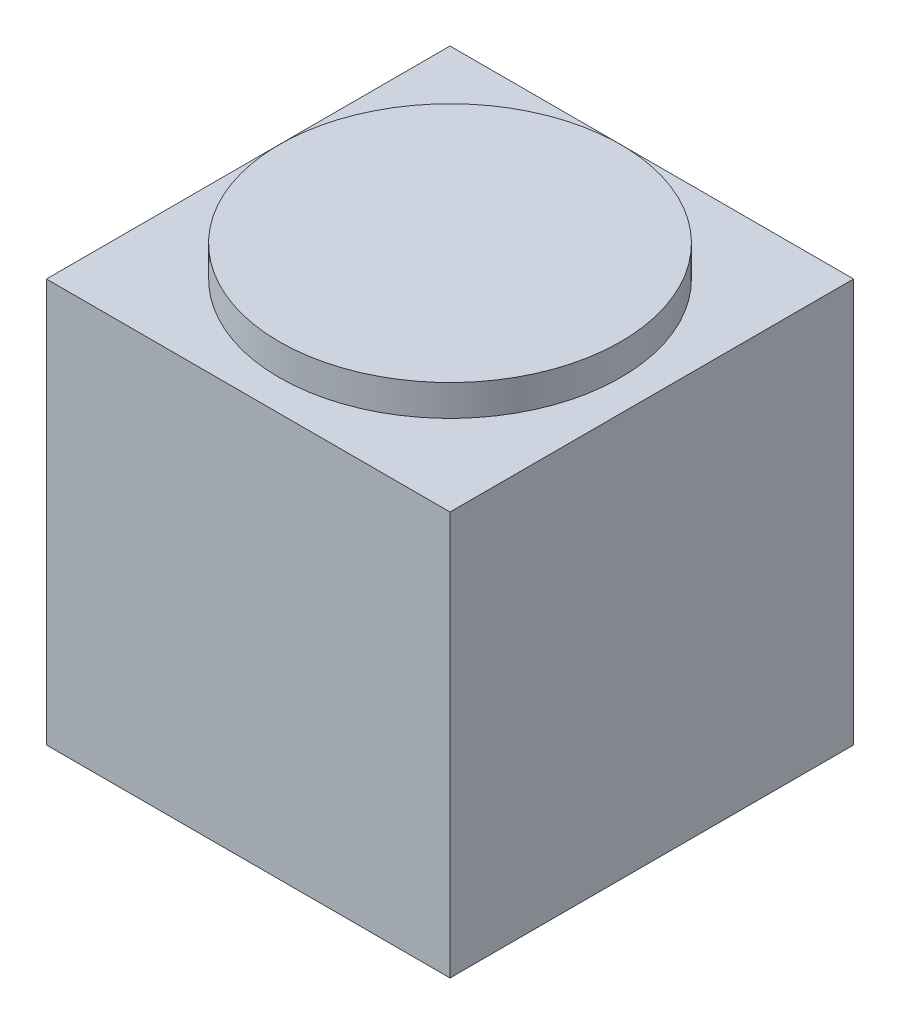
from build123d import *

# Parameters (mm, degrees)
SKETCH1_W           = 130
SKETCH1_H           = 130
BOSS_EXTRUDE1_DEPTH = 65
SKETCH2_R           = 55
BOSS_EXTRUDE2_DEPTH = 10


with BuildPart() as part:
    # Sketch1 → Boss-Extrude1 (new, symmetric)
    with BuildSketch(Plane(origin=(0, 0, 0), x_dir=(1, 0, 0), z_dir=(0, 1, 0))):
        Rectangle(SKETCH1_W, SKETCH1_H)
    extrude(amount=BOSS_EXTRUDE1_DEPTH, both=True)

    # Sketch2 → Boss-Extrude2 (add)
    with BuildSketch(Plane(origin=(0, 65, 0), x_dir=(1, 0, 0), z_dir=(0, 1, 0))):
        with Locations(Location((0, 0, 0), (0, 0, 270))):
            Circle(SKETCH2_R)
    extrude(amount=BOSS_EXTRUDE2_DEPTH)


solid = part.part
